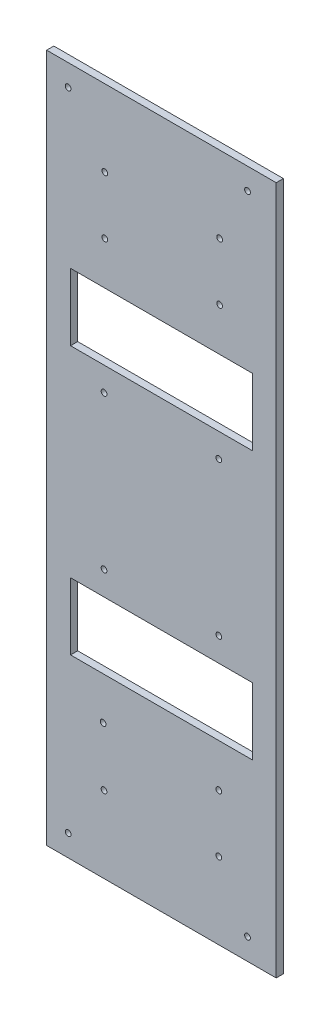
from build123d import *

# Parameters (mm, degrees)
SKETCH1_W           = 152.4
SKETCH1_H           = 457.2
SKETCH1_R           = 1.905
BOSS_EXTRUDE1_DEPTH = 4.7625
CUT_EXTRUDE1_REACH  = 411.779
SKETCH3_R           = 1.905
CUT_EXTRUDE4_REACH  = 411.779
SKETCH6_W           = 120.6373
SKETCH6_H           = 44.403792
SKETCH6_H_2         = 44.496208
SKETCH7_R           = 1.905
CUT_EXTRUDE5_DEPTH  = 410.778918528


with BuildPart() as part:
    # Sketch1 → Boss-Extrude1 (new body)
    with BuildSketch(Plane.XY):
        with Locations((-118.546343616, 131.913442623)):
            Rectangle(SKETCH1_W, SKETCH1_H)
        with Locations(Location((-61.396343616, 346.238642623, 0), (0, 0, 180))):
            Circle(SKETCH1_R, mode=Mode.SUBTRACT)
        with Locations(Location((-180.471543616, 346.238642623, 0), (0, 0, 180))):
            Circle(SKETCH1_R, mode=Mode.SUBTRACT)
        with Locations(Location((-180.471543616, -82.411757377, 0), (0, 0, 180))):
            Circle(SKETCH1_R, mode=Mode.SUBTRACT)
        with Locations(Location((-61.396343616, -82.411757377, 0), (0, 0, 180))):
            Circle(SKETCH1_R, mode=Mode.SUBTRACT)
    extrude(amount=BOSS_EXTRUDE1_DEPTH)

    # Sketch3 → Cut-Extrude1 (cut, up to next)
    with BuildSketch(Plane.XY.offset(4.7625), mode=Mode.PRIVATE) as cut_extrude1_sk1:
        with Locations((-156.633643616, 182.654534623)):
            Circle(SKETCH3_R)
    cut_extrude1_tool1 = extrude(cut_extrude1_sk1.sketch, amount=-CUT_EXTRUDE1_REACH, mode=Mode.PRIVATE) & part.part
    # Sketch3 → Cut-Extrude1 (cut, up to next)
    with BuildSketch(Plane.XY.offset(4.7625), mode=Mode.PRIVATE) as cut_extrude1_sk2:
        with Locations((-80.433643616, 182.654534623)):
            Circle(SKETCH3_R)
    cut_extrude1_tool2 = extrude(cut_extrude1_sk2.sketch, amount=-CUT_EXTRUDE1_REACH, mode=Mode.PRIVATE) & part.part
    # Sketch3 → Cut-Extrude1 (cut, up to next)
    with BuildSketch(Plane.XY.offset(4.7625), mode=Mode.PRIVATE) as cut_extrude1_sk3:
        with Locations((-156.633643616, 81.054534623)):
            Circle(SKETCH3_R)
    cut_extrude1_tool3 = extrude(cut_extrude1_sk3.sketch, amount=-CUT_EXTRUDE1_REACH, mode=Mode.PRIVATE) & part.part
    # Sketch3 → Cut-Extrude1 (cut, up to next)
    with BuildSketch(Plane.XY.offset(4.7625), mode=Mode.PRIVATE) as cut_extrude1_sk4:
        with Locations((-80.433643616, 81.054534623)):
            Circle(SKETCH3_R)
    cut_extrude1_tool4 = extrude(cut_extrude1_sk4.sketch, amount=-CUT_EXTRUDE1_REACH, mode=Mode.PRIVATE) & part.part
    add(cut_extrude1_tool1.solids().sort_by_distance((-156.633644, 182.654535, 4.7625))[0], mode=Mode.SUBTRACT)
    add(cut_extrude1_tool2.solids().sort_by_distance((-80.433644, 182.654535, 4.7625))[0], mode=Mode.SUBTRACT)
    add(cut_extrude1_tool3.solids().sort_by_distance((-156.633644, 81.054535, 4.7625))[0], mode=Mode.SUBTRACT)
    add(cut_extrude1_tool4.solids().sort_by_distance((-80.433644, 81.054535, 4.7625))[0], mode=Mode.SUBTRACT)

    # Sketch6 → Cut-Extrude4 (cut, up to next)
    with BuildSketch(Plane.XY.offset(4.7625), mode=Mode.PRIVATE) as cut_extrude4_sk1:
        with Locations((-118.539993616, 42.977638623)):
            Rectangle(SKETCH6_W, SKETCH6_H)
    cut_extrude4_tool1 = extrude(cut_extrude4_sk1.sketch, amount=-CUT_EXTRUDE4_REACH, mode=Mode.PRIVATE) & part.part
    # Sketch6 → Cut-Extrude4 (cut, up to next)
    with BuildSketch(Plane.XY.offset(4.7625), mode=Mode.PRIVATE) as cut_extrude4_sk2:
        with Locations((-118.539993616, 220.777638623)):
            Rectangle(SKETCH6_W, SKETCH6_H_2)
    cut_extrude4_tool2 = extrude(cut_extrude4_sk2.sketch, amount=-CUT_EXTRUDE4_REACH, mode=Mode.PRIVATE) & part.part
    add(cut_extrude4_tool1.solids().sort_by_distance((-118.539994, 42.977639, 4.7625))[0], mode=Mode.SUBTRACT)
    add(cut_extrude4_tool2.solids().sort_by_distance((-118.539994, 220.777639, 4.7625))[0], mode=Mode.SUBTRACT)

    # Sketch7 → Cut-Extrude5 (cut, through all)
    with BuildSketch(Plane.XY.offset(4.7625)):
        with Locations((-157.236735827, -7.432198967)):
            Circle(SKETCH7_R)
        with Locations((-156.646343616, -45.899257377)):
            Circle(SKETCH7_R)
        with Locations((-80.446343616, -45.899257377)):
            Circle(SKETCH7_R)
        with Locations((-80.446343616, -7.799257377)):
            Circle(SKETCH7_R)
        with Locations((-79.900784131, 271.600742623)):
            Circle(SKETCH7_R)
        with Locations((-79.900784131, 309.700742623)):
            Circle(SKETCH7_R)
        with Locations((-156.100784131, 309.700742623)):
            Circle(SKETCH7_R)
        with Locations((-156.100784131, 271.600742623)):
            Circle(SKETCH7_R)
    extrude(amount=-CUT_EXTRUDE5_DEPTH, mode=Mode.SUBTRACT)


solid = part.part
